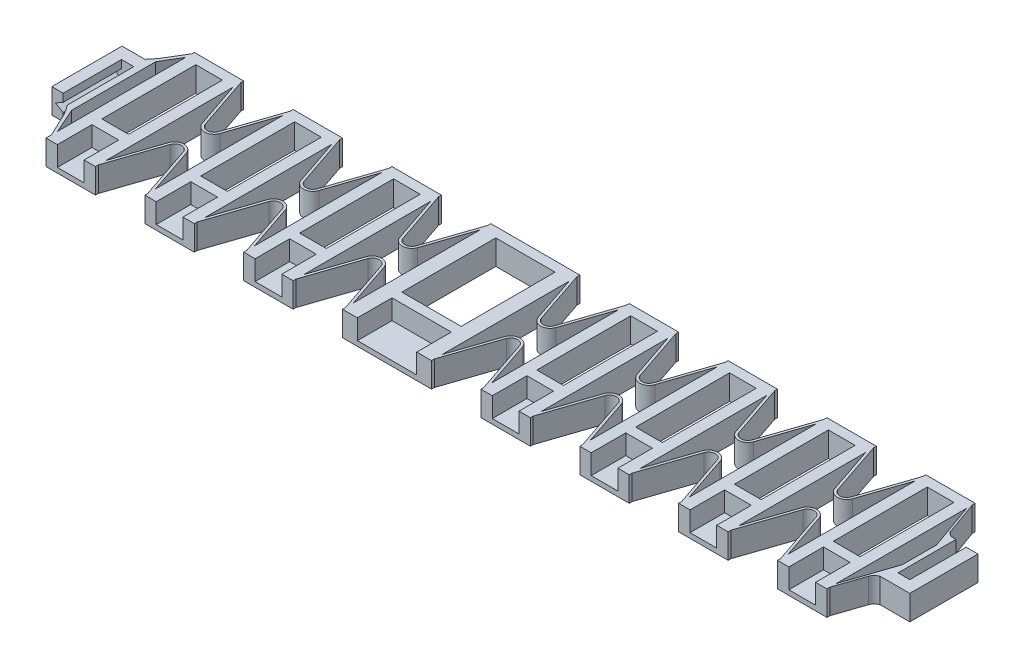
from build123d import *

# Parameters (mm, degrees)
SKETCH1_W           = 12.7
SKETCH1_H           = 38.1
BOSS_EXTRUDE1_DEPTH = 6.35
BOSS_EXTRUDE2_DEPTH = 14.478
CUT_EXTRUDE1_DEPTH  = 14.986
SKETCH6_W           = 6.858
SKETCH6_H           = 24.13
SKETCH6_W_2         = 15.24
CUT_EXTRUDE2_DEPTH  = 207.927564939
SKETCH7_W           = 6.858
SKETCH7_H           = 8.89
SKETCH7_W_2         = 15.24
CUT_EXTRUDE3_DEPTH  = 5.08


with BuildPart() as part:
    # Sketch1 → Boss-Extrude1 (new body)
    with BuildSketch(Plane(origin=(0, 0, 0), x_dir=(1, 0, 0), z_dir=(0, 1, 0))):
        Polygon((-14.127309632, 8.128), (-14.127309632, -6.858), (-17.048309632, -6.858), (-17.048309632, 11.176), (-10.952309632, 11.176), (-10.952309632, 8.128), align=None)
        with BuildLine():
            Line((-6.35, 16.874182362), (-6.35, 18.461039059))
            Line((-6.35, 18.461039059), (-8.772941612, 14.445962886))
            ThreePointArc((-8.772941612, 14.445962886), (-9.770233409, 12.871217812), (-10.952309632, 11.43))
            Line((-10.952309632, 11.43), (-10.952309632, 11.176))
            Line((-10.952309632, 11.176), (-10.952309632, 8.128))
            Line((-10.952309632, 8.128), (-10.952309632, -8.986797255))
            ThreePointArc((-10.952309632, -8.986797255), (-9.594362503, -10.941221031), (-8.546434166, -13.077956603))
            Line((-8.546434166, -13.077956603), (-6.35, -17.608008723))
            Line((-6.35, -17.608008723), (-6.35, -16.101786933))
            Line((-6.35, -16.101786933), (-9.241045051, -9.575340678))
            Line((-9.241045051, -9.575340678), (-9.241045051, 12.033432457))
            Line((-9.241045051, 12.033432457), (-6.35, 16.874182362))
        make_face()
        Rectangle(SKETCH1_W, SKETCH1_H)
        with BuildLine():
            Line((11.015569532, 4.510809347), (6.35, 18.317830642))
            Line((6.35, 18.317830642), (6.35, 16.334259771))
            Line((6.35, 16.334259771), (10.413987222, 4.307526971))
            ThreePointArc((10.413987222, 4.307526971), (12.7, 2.667), (14.986012778, 4.307526971))
            Line((14.986012778, 4.307526971), (19.05, 16.334259771))
            Line((19.05, 16.334259771), (19.05, 18.317830642))
            Line((19.05, 18.317830642), (14.384430468, 4.510809347))
            ThreePointArc((14.384430468, 4.510809347), (12.7, 3.302), (11.015569532, 4.510809347))
        make_face()
        with BuildLine():
            Line((10.413987222, -4.307526971), (6.35, -16.334259771))
            Line((6.35, -16.334259771), (6.35, -18.317830642))
            Line((6.35, -18.317830642), (11.015569532, -4.510809347))
            ThreePointArc((11.015569532, -4.510809347), (12.7, -3.302), (14.384430468, -4.510809347))
            Line((14.384430468, -4.510809347), (19.05, -18.317830642))
            Line((19.05, -18.317830642), (19.05, -16.334259771))
            Line((19.05, -16.334259771), (14.986012778, -4.307526971))
            ThreePointArc((14.986012778, -4.307526971), (12.7, -2.667), (10.413987222, -4.307526971))
        make_face()
        with Locations((25.4, 0)):
            Rectangle(SKETCH1_W, SKETCH1_H)
        with BuildLine():
            Line((35.813987222, -4.307526971), (31.75, -16.334259771))
            Line((31.75, -16.334259771), (31.75, -18.317830642))
            Line((31.75, -18.317830642), (36.415569532, -4.510809347))
            ThreePointArc((36.415569532, -4.510809347), (38.1, -3.302), (39.784430468, -4.510809347))
            Line((39.784430468, -4.510809347), (44.45, -18.317830642))
            Line((44.45, -18.317830642), (44.45, -16.334259771))
            Line((44.45, -16.334259771), (40.386012778, -4.307526971))
            ThreePointArc((40.386012778, -4.307526971), (38.1, -2.667), (35.813987222, -4.307526971))
        make_face()
        with BuildLine():
            Line((36.415569532, 4.510809347), (31.75, 18.317830642))
            Line((31.75, 18.317830642), (31.75, 16.334259771))
            Line((31.75, 16.334259771), (35.813987222, 4.307526971))
            ThreePointArc((35.813987222, 4.307526971), (38.1, 2.667), (40.386012778, 4.307526971))
            Line((40.386012778, 4.307526971), (44.45, 16.334259771))
            Line((44.45, 16.334259771), (44.45, 18.317830642))
            Line((44.45, 18.317830642), (39.784430468, 4.510809347))
            ThreePointArc((39.784430468, 4.510809347), (38.1, 3.302), (36.415569532, 4.510809347))
        make_face()
        Polygon((44.45, 19.05), (44.45, 18.317830642), (44.45, 16.334259771), (44.45, -16.334259771), (44.45, -18.317830642), (44.45, -19.05), (57.15, -19.05), (57.15, -18.317830642), (57.15, -18.142387887), (57.15, -16.334259771), (57.15, -15.725591407), (57.15, 15.748970625), (57.15, 16.334259771), (57.15, 18.165767106), (57.15, 18.317830642), (57.15, 19.05), align=None)
        with BuildLine():
            Line((61.815569532, 4.510809347), (57.15, 18.317830642))
            Line((57.15, 18.317830642), (57.15, 18.165767106))
            Line((57.15, 18.165767106), (57.15, 16.334259771))
            Line((57.15, 16.334259771), (61.213987222, 4.307526971))
            ThreePointArc((61.213987222, 4.307526971), (63.5, 2.667), (65.786012778, 4.307526971))
            Line((65.786012778, 4.307526971), (69.85, 16.334259771))
            Line((69.85, 16.334259771), (69.85, 18.317830642))
            Line((69.85, 18.317830642), (65.184430468, 4.510809347))
            ThreePointArc((65.184430468, 4.510809347), (63.5, 3.302), (61.815569532, 4.510809347))
        make_face()
        with BuildLine():
            Line((57.15, -18.142387887), (57.15, -18.317830642))
            Line((57.15, -18.317830642), (61.815569532, -4.510809347))
            ThreePointArc((61.815569532, -4.510809347), (63.5, -3.302), (65.184430468, -4.510809347))
            Line((65.184430468, -4.510809347), (69.85, -18.317830642))
            Line((69.85, -18.317830642), (69.85, -16.334259771))
            Line((69.85, -16.334259771), (65.786012778, -4.307526971))
            ThreePointArc((65.786012778, -4.307526971), (63.5, -2.667), (61.213987222, -4.307526971))
            Line((61.213987222, -4.307526971), (57.15, -16.334259771))
            Line((57.15, -16.334259771), (57.15, -18.142387887))
        make_face()
        Polygon((69.85, 18.483110435), (69.85, 18.317830642), (69.85, 16.334259771), (69.85, 16.135977183), (69.85, -16.112597964), (69.85, -16.334259771), (69.85, -18.317830642), (69.85, -18.459731217), (69.85, -19.05), (92.71, -19.05), (92.71, -18.459731217), (92.71, -18.317830642), (92.71, -16.334259771), (92.71, -16.112597964), (92.71, 16.334259771), (92.71, 18.317830642), (92.71, 19.05), (69.85, 19.05), align=None)
        with BuildLine():
            Line((97.375569532, 4.510809347), (92.71, 18.317830642))
            Line((92.71, 18.317830642), (92.71, 16.334259771))
            Line((92.71, 16.334259771), (96.773987222, 4.307526971))
            ThreePointArc((96.773987222, 4.307526971), (99.06, 2.667), (101.346012778, 4.307526971))
            Line((101.346012778, 4.307526971), (105.41, 16.334259771))
            Line((105.41, 16.334259771), (105.41, 18.317830642))
            Line((105.41, 18.317830642), (100.744430468, 4.510809347))
            ThreePointArc((100.744430468, 4.510809347), (99.06, 3.302), (97.375569532, 4.510809347))
        make_face()
        with BuildLine():
            Line((96.773987222, -4.307526971), (92.71, -16.334259771))
            Line((92.71, -16.334259771), (92.71, -18.317830642))
            Line((92.71, -18.317830642), (97.375569532, -4.510809347))
            ThreePointArc((97.375569532, -4.510809347), (99.06, -3.302), (100.744430468, -4.510809347))
            Line((100.744430468, -4.510809347), (105.41, -18.317830642))
            Line((105.41, -18.317830642), (105.41, -18.142387887))
            Line((105.41, -18.142387887), (105.41, -16.334259771))
            Line((105.41, -16.334259771), (101.346012778, -4.307526971))
            ThreePointArc((101.346012778, -4.307526971), (99.06, -2.667), (96.773987222, -4.307526971))
        make_face()
        Polygon((105.41, 19.05), (105.41, 18.317830642), (105.41, 16.334259771), (105.41, -15.725591407), (105.41, -16.334259771), (105.41, -18.142387887), (105.41, -18.317830642), (105.41, -19.05), (118.11, -19.05), (118.11, -18.459731217), (118.11, -18.317830642), (118.11, -16.334259771), (118.11, -16.112597964), (118.11, 15.949235205), (118.11, 16.334259771), (118.11, 18.317830642), (118.11, 18.329520251), (118.11, 19.05), align=None)
        with BuildLine():
            Line((148.175569532, 4.510809347), (143.51, 18.317830642))
            Line((143.51, 18.317830642), (143.51, 16.334259771))
            Line((143.51, 16.334259771), (147.573987222, 4.307526971))
            ThreePointArc((147.573987222, 4.307526971), (149.86, 2.667), (152.146012778, 4.307526971))
            Line((152.146012778, 4.307526971), (156.21, 16.334259771))
            Line((156.21, 16.334259771), (156.21, 18.317830642))
            Line((156.21, 18.317830642), (151.544430468, 4.510809347))
            ThreePointArc((151.544430468, 4.510809347), (149.86, 3.302), (148.175569532, 4.510809347))
        make_face()
        Polygon((130.81, 18.329520251), (130.81, 18.317830642), (130.81, 16.334259771), (130.81, 15.949235205), (130.81, -15.725591407), (130.81, -16.334259771), (130.81, -18.142387887), (130.81, -18.317830642), (130.81, -19.05), (143.51, -19.05), (143.51, -18.317830642), (143.51, -16.334259771), (143.51, 16.334259771), (143.51, 18.317830642), (143.51, 19.05), (130.81, 19.05), align=None)
        with BuildLine():
            Line((118.11, -16.334259771), (118.11, -18.317830642))
            Line((118.11, -18.317830642), (122.775569532, -4.510809347))
            ThreePointArc((122.775569532, -4.510809347), (124.46, -3.302), (126.144430468, -4.510809347))
            Line((126.144430468, -4.510809347), (130.81, -18.317830642))
            Line((130.81, -18.317830642), (130.81, -18.142387887))
            Line((130.81, -18.142387887), (130.81, -16.334259771))
            Line((130.81, -16.334259771), (126.746012778, -4.307526971))
            ThreePointArc((126.746012778, -4.307526971), (124.46, -2.667), (122.173987222, -4.307526971))
            Line((122.173987222, -4.307526971), (118.11, -16.334259771))
        make_face()
        with BuildLine():
            Line((173.575569532, 4.510809347), (168.91, 18.317830642))
            Line((168.91, 18.317830642), (168.91, 16.334259771))
            Line((168.91, 16.334259771), (172.973987222, 4.307526971))
            ThreePointArc((172.973987222, 4.307526971), (175.26, 2.667), (177.546012778, 4.307526971))
            Line((177.546012778, 4.307526971), (181.61, 16.334259771))
            Line((181.61, 16.334259771), (181.61, 18.317830642))
            Line((181.61, 18.317830642), (176.944430468, 4.510809347))
            ThreePointArc((176.944430468, 4.510809347), (175.26, 3.302), (173.575569532, 4.510809347))
        make_face()
        with Locations((162.56, 0)):
            Rectangle(SKETCH1_W, SKETCH1_H)
        with BuildLine():
            ThreePointArc((198.326451369, -9.398), (197.433478217, -9.961460267), (196.830701464, -10.828379358))
            Line((196.830701464, -10.828379358), (194.31, -18.288))
            Line((194.31, -18.288), (194.31, -16.701143303))
            Line((194.31, -16.701143303), (198.60830494, -3.980983966))
            Line((198.60830494, -3.980983966), (198.60830494, 4.854154139))
            Line((198.60830494, 4.854154139), (194.31, 16.899575801))
            Line((194.31, 16.899575801), (194.31, 18.288))
            Line((194.31, 18.288), (197.390936673, 9.654089226))
            ThreePointArc((197.390936673, 9.654089226), (198.241416647, 8.768403972), (199.449886075, 8.550789182))
            Line((199.449886075, 8.550789182), (199.872517067, 8.550789182))
            Line((199.872517067, 8.550789182), (199.872517067, 0))
            Line((199.872517067, 0), (199.872517067, -6.35))
            Line((199.872517067, -6.35), (202.902945936, -6.35))
            Line((202.902945936, -6.35), (202.902945936, 8.128))
            Line((202.902945936, 8.128), (205.950945936, 8.128))
            Line((205.950945936, 8.128), (205.950945936, -7.790631163))
            Line((205.950945936, -7.790631163), (205.950945936, -9.398))
            Line((205.950945936, -9.398), (202.140945936, -9.398))
            Line((202.140945936, -9.398), (198.326451369, -9.398))
        make_face()
        with Locations((187.96, 0)):
            Rectangle(SKETCH1_W, SKETCH1_H)
        with BuildLine():
            ThreePointArc((126.144430468, 4.510809347), (124.46, 3.302), (122.775569532, 4.510809347))
            Line((122.775569532, 4.510809347), (118.11, 18.317830642))
            Line((118.11, 18.317830642), (118.11, 16.334259771))
            Line((118.11, 16.334259771), (122.173987222, 4.307526971))
            ThreePointArc((122.173987222, 4.307526971), (124.46, 2.667), (126.746012778, 4.307526971))
            Line((126.746012778, 4.307526971), (130.81, 16.334259771))
            Line((130.81, 16.334259771), (130.81, 18.317830642))
            Line((130.81, 18.317830642), (126.144430468, 4.510809347))
        make_face()
        with BuildLine():
            ThreePointArc((148.175569532, -4.510809347), (149.86, -3.302), (151.544430468, -4.510809347))
            Line((151.544430468, -4.510809347), (156.21, -18.317830642))
            Line((156.21, -18.317830642), (156.21, -16.334259771))
            Line((156.21, -16.334259771), (152.146012778, -4.307526971))
            ThreePointArc((152.146012778, -4.307526971), (149.86, -2.667), (147.573987222, -4.307526971))
            Line((147.573987222, -4.307526971), (143.51, -16.334259771))
            Line((143.51, -16.334259771), (143.51, -18.317830642))
            Line((143.51, -18.317830642), (148.175569532, -4.510809347))
        make_face()
        with BuildLine():
            ThreePointArc((176.944430468, -4.510809347), (175.26, -3.302), (173.575569532, -4.510809347))
            Line((173.575569532, -4.510809347), (168.91, -18.317830642))
            Line((168.91, -18.317830642), (168.91, -16.334259771))
            Line((168.91, -16.334259771), (172.973987222, -4.307526971))
            ThreePointArc((172.973987222, -4.307526971), (175.26, -2.667), (177.546012778, -4.307526971))
            Line((177.546012778, -4.307526971), (181.61, -16.334259771))
            Line((181.61, -16.334259771), (181.61, -18.317830642))
            Line((181.61, -18.317830642), (176.944430468, -4.510809347))
        make_face()
    extrude(amount=BOSS_EXTRUDE1_DEPTH)

    # Sketch2 → Boss-Extrude2 (add)
    with BuildSketch(Plane(origin=(0, 0, 6.35), x_dir=(-1, 0, 0), z_dir=(0, 0, -1))):
        Polygon((-202.902945936, 2.032), (-202.902945936, 4.318), (-200.923211863, 3.175), align=None)
    extrude(amount=BOSS_EXTRUDE2_DEPTH)

    # Sketch3 → Cut-Extrude1 (cut)
    with BuildSketch(Plane.XY.offset(-8.128)):
        Polygon((-14.127309632, 2.032), (-14.127309632, 4.318), (-16.107043705, 3.175), align=None)
    extrude(amount=CUT_EXTRUDE1_DEPTH, mode=Mode.SUBTRACT)

    # Sketch6 → Cut-Extrude2 (cut, through all)
    with BuildSketch(Plane(origin=(0, 6.35, 0), x_dir=(1, 0, 0), z_dir=(0, 1, 0))):
        with Locations((25.4, 4.445)):
            Rectangle(SKETCH6_W, SKETCH6_H)
        with Locations((0, 4.445)):
            Rectangle(SKETCH6_W, SKETCH6_H)
        with Locations((50.8, 4.445)):
            Rectangle(SKETCH6_W, SKETCH6_H)
        with Locations((111.76, 4.445)):
            Rectangle(SKETCH6_W, SKETCH6_H)
        with Locations((137.16, 4.445)):
            Rectangle(SKETCH6_W, SKETCH6_H)
        with Locations((162.56, 4.445)):
            Rectangle(SKETCH6_W, SKETCH6_H)
        with Locations((187.96, 4.445)):
            Rectangle(SKETCH6_W, SKETCH6_H)
        with Locations((81.28, 4.445)):
            Rectangle(SKETCH6_W_2, SKETCH6_H)
    extrude(amount=-CUT_EXTRUDE2_DEPTH, mode=Mode.SUBTRACT)

    # Sketch7 → Cut-Extrude3 (cut)
    with BuildSketch(Plane(origin=(0, 6.35, 0), x_dir=(1, 0, 0), z_dir=(0, 1, 0))):
        with Locations((0, -14.605)):
            Rectangle(SKETCH7_W, SKETCH7_H)
        with Locations((25.4, -14.605)):
            Rectangle(SKETCH7_W, SKETCH7_H)
        with Locations((50.8, -14.605)):
            Rectangle(SKETCH7_W, SKETCH7_H)
        with Locations((162.56, -14.605)):
            Rectangle(SKETCH7_W, SKETCH7_H)
        with Locations((137.16, -14.605)):
            Rectangle(SKETCH7_W, SKETCH7_H)
        with Locations((111.76, -14.605)):
            Rectangle(SKETCH7_W, SKETCH7_H)
        with Locations((187.96, -14.605)):
            Rectangle(SKETCH7_W, SKETCH7_H)
        with Locations((81.28, -14.605)):
            Rectangle(SKETCH7_W_2, SKETCH7_H)
    extrude(amount=-CUT_EXTRUDE3_DEPTH, mode=Mode.SUBTRACT)


solid = part.part
